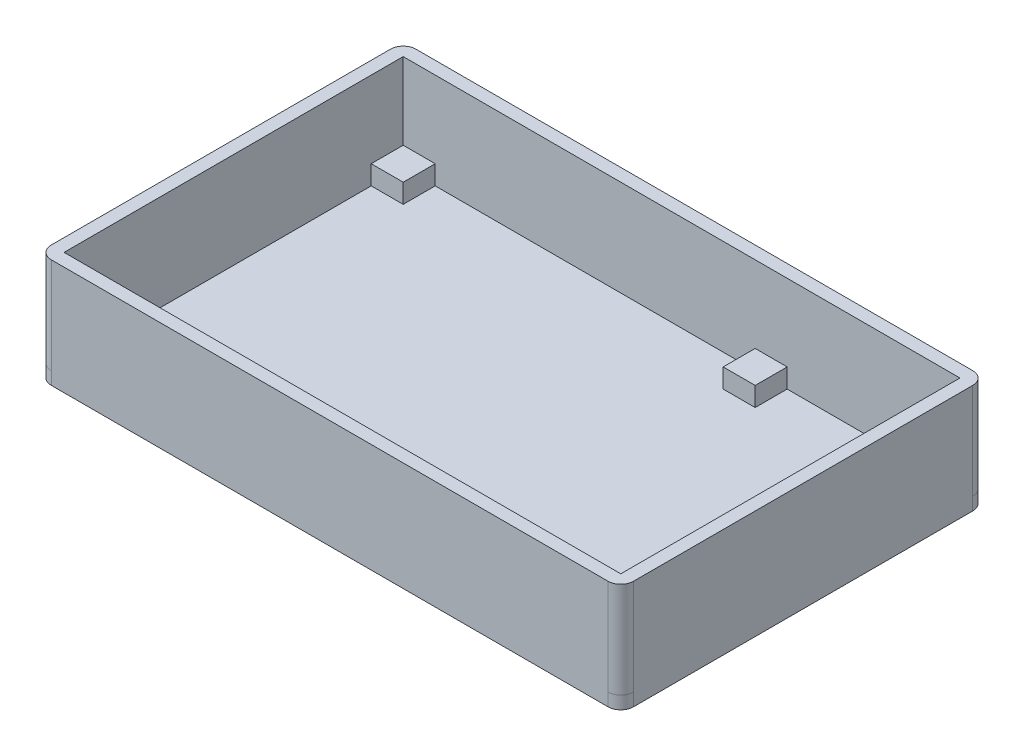
from build123d import *

# Parameters (mm, degrees)
SKETCH1_W           = 91
SKETCH1_H           = 57
BOSS_EXTRUDE1_DEPTH = 2
FILLET1_R           = 2
SKETCH2_W           = 91
SKETCH2_H           = 57
SKETCH2_W_2         = 87
SKETCH2_H_2         = 53
BOSS_EXTRUDE6_DEPTH = 15
FILLET2_R           = 2
SKETCH13_W          = 5
SKETCH13_H          = 5
BOSS_EXTRUDE7_DEPTH = 3


with BuildPart() as part:
    # Sketch1 → Boss-Extrude1 (new body)
    with BuildSketch(Plane(origin=(0, 0, 0), x_dir=(1, 0, 0), z_dir=(0, 1, 0))):
        with Locations((45.5, 28.5)):
            Rectangle(SKETCH1_W, SKETCH1_H)
    extrude(amount=BOSS_EXTRUDE1_DEPTH)

    # Fillet1
    fillet1_edges = [part.edges().sort_by_distance(p)[0] for p in [
        (0, 1, -57),
        (91, 1, -57),
        (91, 1, 0),
        (0, 1, 0),
    ]]
    fillet(fillet1_edges, radius=FILLET1_R)

    # Sketch2 → Boss-Extrude6 (add)
    with BuildSketch(Plane(origin=(0, 2, 0), x_dir=(1, 0, 0), z_dir=(0, 1, 0))):
        with Locations((45.5, 28.5)):
            Rectangle(SKETCH2_W, SKETCH2_H)
        with Locations((45.5, 28.5)):
            Rectangle(SKETCH2_W_2, SKETCH2_H_2, mode=Mode.SUBTRACT)
    extrude(amount=BOSS_EXTRUDE6_DEPTH)

    # Fillet2
    fillet2_edges = [part.edges().sort_by_distance(p)[0] for p in [
        (0, 9.5, -57),
        (91, 9.5, -57),
        (91, 9.5, 0),
        (0, 9.5, 0),
    ]]
    fillet(fillet2_edges, radius=FILLET2_R)

    # Sketch13 → Boss-Extrude7 (add)
    with BuildSketch(Plane(origin=(0, 2, 0), x_dir=(1, 0, 0), z_dir=(0, 1, 0))):
        with Locations((4.5, 52.5)):
            Rectangle(SKETCH13_W, SKETCH13_H)
        with Locations((4.5, 4.5)):
            Rectangle(SKETCH13_W, SKETCH13_H)
        with Locations((59.5, 52.5)):
            Rectangle(SKETCH13_W, SKETCH13_H)
        with Locations((59.5, 4.5)):
            Rectangle(SKETCH13_W, SKETCH13_H)
    extrude(amount=BOSS_EXTRUDE7_DEPTH)


solid = part.part
